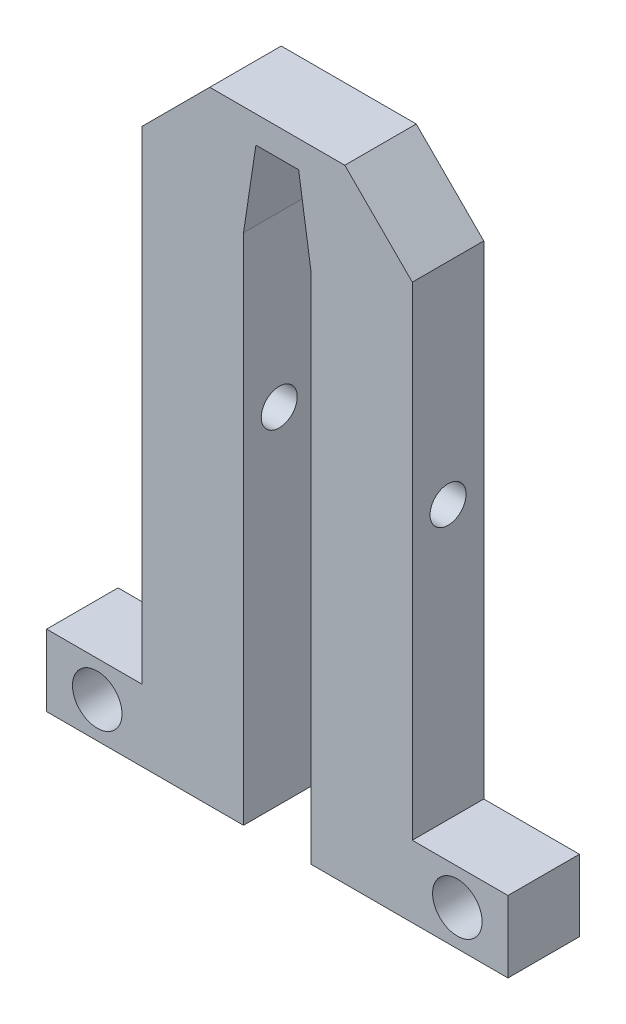
from build123d import *

# Parameters (mm, degrees)
BOSS_EXTRUDE1_DEPTH         = 3.175
CHAMFER1_SIZE               = 3
TAP_DRILL_FOR_M2X0_4_TAP1_D = 1.6
M2_CLEARANCE_HOLE1_D        = 2.2


with BuildPart() as part:
    # Sketch1 → Boss-Extrude1 (new body)
    with BuildSketch(Plane.XY):
        Polygon((6, 27.65), (-6, 27.65), (-6, 3.175), (-10.25, 3.175), (-10.25, 0), (-1.5, 0), (-1.5, 22.8), (-0.95, 26.45), (0.95, 26.45), (1.5, 22.8), (1.5, 0), (10.25, 0), (10.25, 3.175), (6, 3.175), align=None)
    extrude(amount=BOSS_EXTRUDE1_DEPTH)

    # Chamfer1
    chamfer1_edges = [part.edges().sort_by_distance(p)[0] for p in [
        (-6, 27.65, 1.5875),
        (6, 27.65, 1.5875),
    ]]
    chamfer(chamfer1_edges, length=CHAMFER1_SIZE)

    # Tap Drill for M2x0.4 Tap1 (through all)
    with Locations(Plane(origin=(6, 0, 0), x_dir=(0, 0, -1), z_dir=(1, 0, 0))):
        with Locations((-1.5875, 15.3)):
            Hole(TAP_DRILL_FOR_M2X0_4_TAP1_D / 2)

    # M2 Clearance Hole1 (through all)
    with Locations(Plane.XY.offset(3.175)):
        with Locations((-8, 1.5875), (8, 1.5875)):
            Hole(M2_CLEARANCE_HOLE1_D / 2)


solid = part.part
